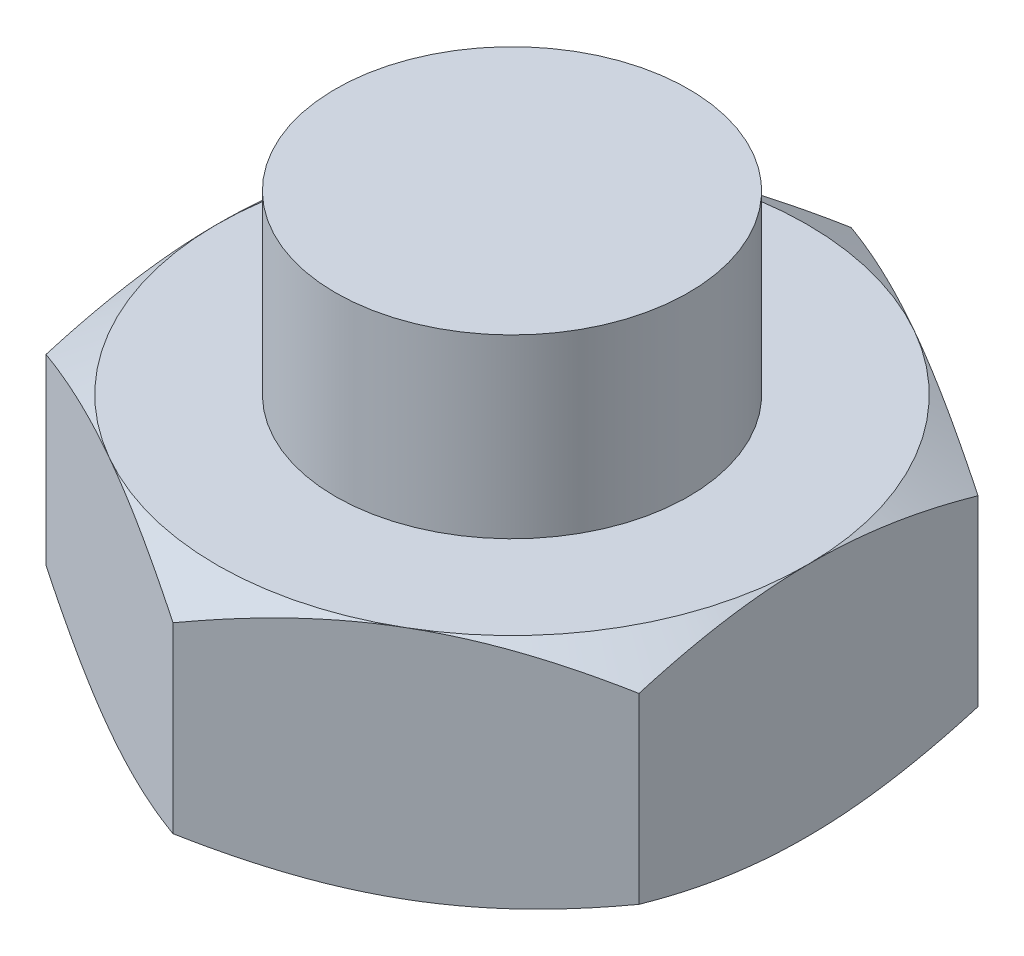
from build123d import *

# Parameters (mm, degrees)
BOSS_EXTRUDE1_DEPTH = 4
SKETCH2_OUTSIDE_W   = 29.082
SKETCH2_OUTSIDE_H   = 30.606
SKETCH2_OUTSIDE_R   = 5.014305997
CUT_EXTRUDE1_DEPTH  = 4
CUT_EXTRUDE1_DRAFT  = -60
SKETCH3_OUTSIDE_W   = 29.082
SKETCH3_OUTSIDE_H   = 30.606
SKETCH3_OUTSIDE_R   = 5.014305997
CUT_EXTRUDE2_DEPTH  = 4
CUT_EXTRUDE2_DRAFT  = -60
SKETCH4_R           = 3
BOSS_EXTRUDE3_DEPTH = 3


with BuildPart() as part:
    # Sketch1 → Boss-Extrude1 (new body)
    with BuildSketch(Plane(origin=(0, 0, 0), x_dir=(1, 0, 0), z_dir=(0, 1, 0))):
        Polygon((5, 2.919649438), (-0.028490583, 5.789951738), (-5.028490583, 2.8703023), (-5, -2.919649438), (0.028490583, -5.789951738), (5.028490583, -2.8703023), align=None)
    extrude(amount=BOSS_EXTRUDE1_DEPTH)


with BuildPart() as cut_extrude1_tool:
    # Sketch2 outside → Cut-Extrude1 (with draft: the straight prism first)
    with BuildSketch(Plane(origin=(0, 4, 0), x_dir=(1, 0, 0), z_dir=(0, 1, 0))):
        Rectangle(SKETCH2_OUTSIDE_W, SKETCH2_OUTSIDE_H)
        Circle(SKETCH2_OUTSIDE_R, mode=Mode.SUBTRACT)
    extrude(amount=-CUT_EXTRUDE1_DEPTH)
    # Cut-Extrude1: the draft: its side faces are tilted about the plane it starts from
    cut_extrude1_sides = [cut_extrude1_tool.faces().sort_by_distance(p)[0] for p in [
        (0, 2, 15.303),
        (14.541, 2, 0),
        (0, 2, -15.303),
        (-14.541, 2, 0),
        (-5.014305997, 2, 0),
    ]]
    draft(cut_extrude1_sides, Plane(origin=(0, 4, 0), x_dir=(1, 0, 0), z_dir=(0, 1, 0)), CUT_EXTRUDE1_DRAFT)


with BuildPart() as part_1:
    add(part.part)

    # Cut-Extrude1: cut by cut_extrude1_tool
    add(cut_extrude1_tool.part, mode=Mode.SUBTRACT)


with BuildPart() as cut_extrude2_tool:
    # Sketch3 outside → Cut-Extrude2 (with draft: the straight prism first)
    with BuildSketch(Plane.XZ):
        Rectangle(SKETCH3_OUTSIDE_W, SKETCH3_OUTSIDE_H)
        Circle(SKETCH3_OUTSIDE_R, mode=Mode.SUBTRACT)
    extrude(amount=-CUT_EXTRUDE2_DEPTH)
    # Cut-Extrude2: the draft: its side faces are tilted about the plane it starts from
    cut_extrude2_sides = [cut_extrude2_tool.faces().sort_by_distance(p)[0] for p in [
        (0, 2, -15.303),
        (14.541, 2, 0),
        (0, 2, 15.303),
        (-14.541, 2, 0),
        (-5.014305997, 2, 0),
    ]]
    draft(cut_extrude2_sides, Plane.XZ, CUT_EXTRUDE2_DRAFT)


with BuildPart() as part_2:
    add(part_1.part)

    # Cut-Extrude2: cut by cut_extrude2_tool
    add(cut_extrude2_tool.part, mode=Mode.SUBTRACT)

    # Sketch4 → Boss-Extrude3 (add)
    with BuildSketch(Plane(origin=(0, 4, 0), x_dir=(1, 0, 0), z_dir=(0, 1, 0))):
        with Locations(Location((0, 0, 0), (0, 0, 270))):
            Circle(SKETCH4_R)
    extrude(amount=BOSS_EXTRUDE3_DEPTH)


solid = part_2.part
